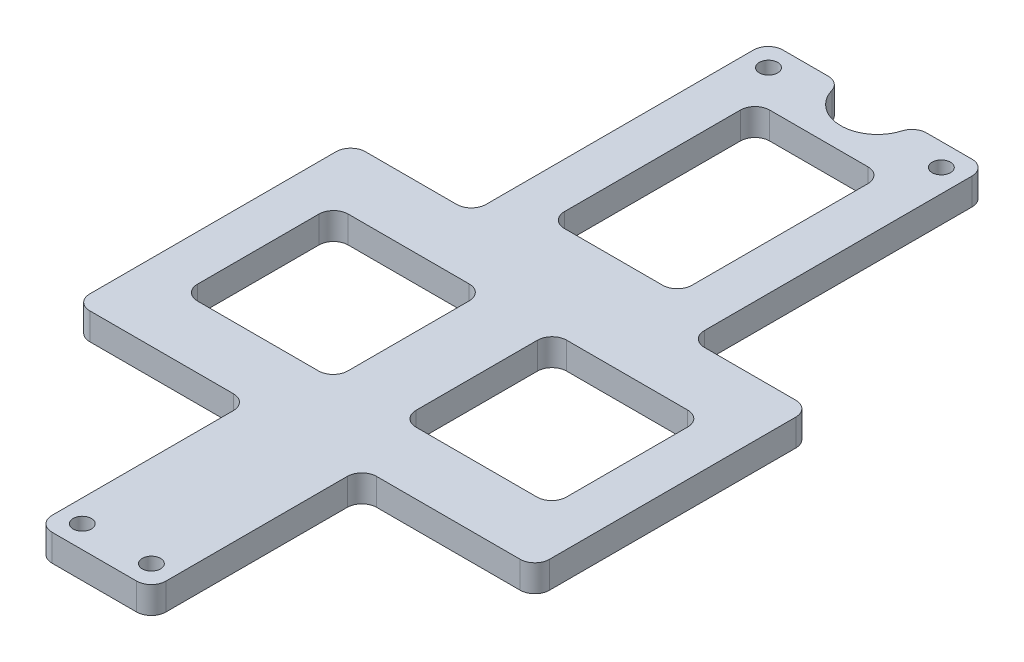
from build123d import *

# Parameters (mm, degrees)
SKETCH1_W                    = 79.6544
SKETCH1_H                    = 135.6868
BOSS_EXTRUDE1_DEPTH          = 4.6482
SKETCH2_W                    = 20.9042
SKETCH2_H                    = 51.435
SKETCH2_W_2                  = 22.098
SKETCH2_H_2                  = 35.56
SKETCH2_W_3                  = 26.0477
SKETCH2_H_3                  = 26.1112
SKETCH2_W_4                  = 29.9593
SKETCH2_H_4                  = 36.4998
CUT_EXTRUDE1_DEPTH           = 79.806970165
F_1_8_0_125_DIAMETER_HOLE1_D = 3.175
FILLET1_R                    = 2.54


with BuildPart() as part:
    # Sketch1 → Boss-Extrude1 (new body)
    with BuildSketch(Plane(origin=(0, 0, 0), x_dir=(1, 0, 0), z_dir=(0, 1, 0))):
        Rectangle(SKETCH1_W, SKETCH1_H)
    extrude(amount=BOSS_EXTRUDE1_DEPTH)

    # Sketch2 → Cut-Extrude1 (cut, through all)
    with BuildSketch(Plane(origin=(0, 4.6482, 0), x_dir=(1, 0, 0), z_dir=(0, 1, 0))):
        with Locations((29.3751, 42.1259)):
            Rectangle(SKETCH2_W, SKETCH2_H)
        with Locations((0, 39.9034)):
            Rectangle(SKETCH2_W_2, SKETCH2_H_2)
        with Locations((18.92935, -7.493)):
            Rectangle(SKETCH2_W_3, SKETCH2_H_3)
        with Locations((-18.92935, -7.493)):
            Rectangle(SKETCH2_W_3, SKETCH2_H_3)
        with Locations((-24.84755, -49.5935)):
            Rectangle(SKETCH2_W_4, SKETCH2_H_4)
        with Locations((24.84755, -49.5935)):
            Rectangle(SKETCH2_W_4, SKETCH2_H_4)
        with BuildLine():
            Line((6.35, 67.8434), (-6.35, 67.8434))
            ThreePointArc((-6.35, 67.8434), (0, 61.4934), (6.35, 67.8434))
        make_face()
        with BuildLine():
            ThreePointArc((6.35, 67.8434), (0, 74.1934), (-6.35, 67.8434))
            Line((-6.35, 67.8434), (6.35, 67.8434))
        make_face()
        with Locations((-29.3751, 42.1259)):
            Rectangle(SKETCH2_W, SKETCH2_H)
    extrude(amount=-CUT_EXTRUDE1_DEPTH, mode=Mode.SUBTRACT)

    # 1/8 (0.125) Diameter Hole1 (through all)
    with Locations(Plane(origin=(-14.9733, 4.6482, -63.9445), x_dir=(0, 0, 1), z_dir=(0, 1, 0))):
        with Locations((0, 0), (0, 29.9466), (127.889, 20.96135), (127.889, 8.98525)):
            Hole(F_1_8_0_125_DIAMETER_HOLE1_D / 2)

    # Fillet1
    fillet1_edges = [part.edges().sort_by_distance(p)[0] for p in [
        (-9.8679, 2.3241, 67.8434),
        (-39.8272, 2.3241, 31.3436),
        (-9.8679, 2.3241, 31.3436),
        (-5.9055, 2.3241, -5.5626),
        (-5.9055, 2.3241, 20.5486),
        (-31.9532, 2.3241, 20.5486),
        (-31.9532, 2.3241, -5.5626),
        (31.9532, 2.3241, -5.5626),
        (31.9532, 2.3241, 20.5486),
        (5.9055, 2.3241, 20.5486),
        (5.9055, 2.3241, -5.5626),
        (11.049, 2.3241, -22.1234),
        (-11.049, 2.3241, -22.1234),
        (-11.049, 2.3241, -57.6834),
        (11.049, 2.3241, -57.6834),
        (9.8679, 2.3241, 67.8434),
        (9.8679, 2.3241, 31.3436),
        (39.8272, 2.3241, 31.3436),
        (-6.35, 2.3241, -67.8434),
        (6.35, 2.3241, -67.8434),
        (-18.923, 2.3241, -67.8434),
        (-18.923, 2.3241, -16.4084),
        (-39.8272, 2.3241, -16.4084),
        (18.923, 2.3241, -67.8434),
        (39.8272, 2.3241, -16.4084),
        (18.923, 2.3241, -16.4084),
    ]]
    fillet(fillet1_edges, radius=FILLET1_R)


solid = part.part
